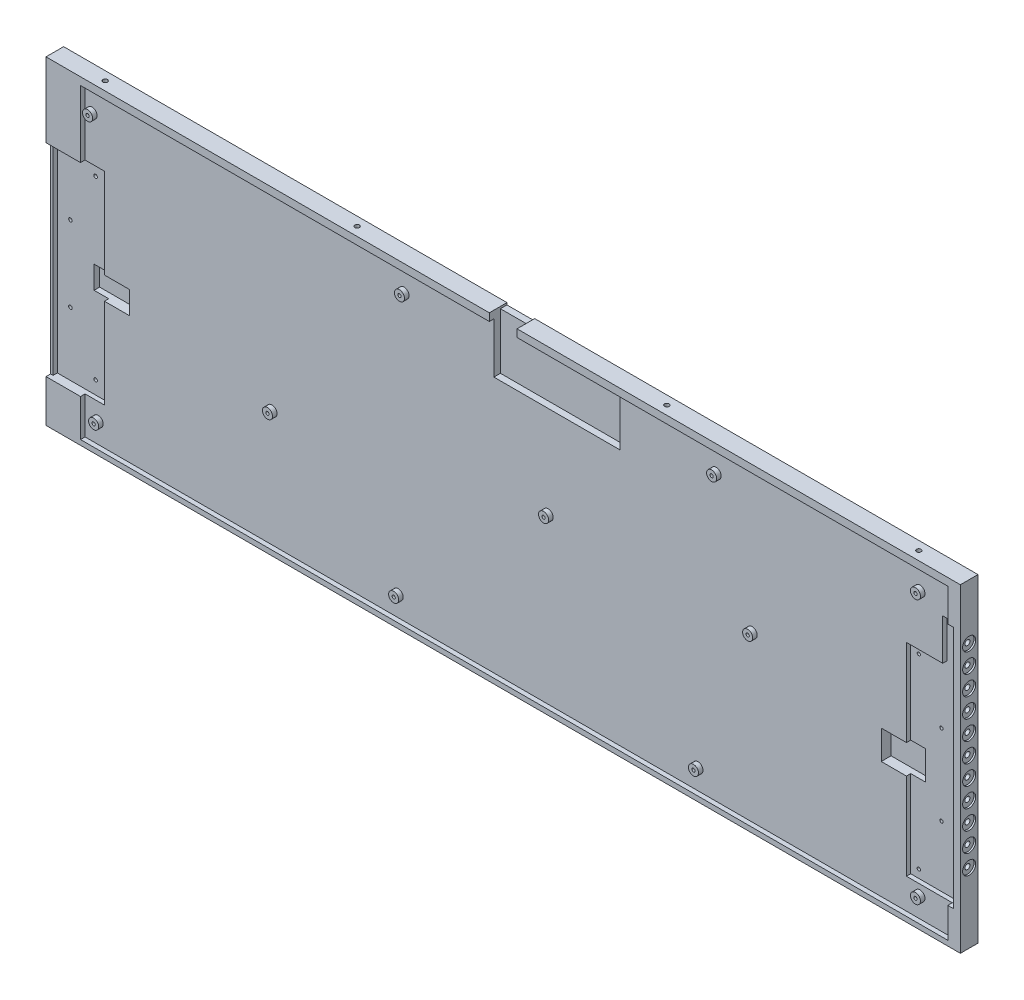
from build123d import *

# Parameters (mm, degrees)
SKETCH_1_W                      = 348.235
SKETCH_1_H                      = 124.71
EXTRUDE_1_DEPTH                 = 7
SKETCH_2_W                      = 344.235
SKETCH_2_H                      = 120.71
CUT_EXTRUDE_1_DEPTH             = 1.8
SKETCH_3_R                      = 2
SKETCH_3_R_2                    = 0.65
EXTRUDE_2_DEPTH                 = 1.8
CUT_EXTRUDE_2_DEPTH             = 370.92869492
CUT_EXTRUDE_2_DEPTH_BACK        = 1.7
SKETCH_4_W                      = 9.7
SKETCH_4_H                      = 80.4
SKETCH_6_W                      = 15.8
SKETCH_6_H                      = 9
CUT_EXTRUDE_3_DEPTH             = 3.9
SKETCH_7_W                      = 3.5
SKETCH_7_H                      = 80.4
EXTRUDE_3_DEPTH                 = 11.7
SKETCH_8_R                      = 0.7
CUT_EXTRUDE_4_DEPTH             = 3
SKETCH_9_W                      = 1
SKETCH_9_H                      = 80.4
EXTRUDE_4_DEPTH                 = 1.7
CUT_EXTRUDE_5_DEPTH             = 370.92869492
CUT_EXTRUDE_5_DEPTH_BACK        = 1.7
SKETCH_10_W                     = 20.2
SKETCH_10_H                     = 80.4
CUT_EXTRUDE_6_DEPTH             = 370.908704041
CUT_EXTRUDE_6_DEPTH_BACK        = 2.2
SKETCH_11_W                     = 15.8
SKETCH_11_H                     = 11.5
SKETCH_12_R                     = 0.65
CUT_EXTRUDE_7_DEPTH             = 3
SKETCH_13_W                     = 3
SKETCH_13_H                     = 124.71
EXTRUDE_5_DEPTH                 = 7
CUT_EXTRUDE_8_REACH             = 374.754
SKETCH_14_W                     = 6
SKETCH_14_H                     = 96.71
CUT_EXTRUDE_8_DIRECTION_2_DEPTH = 3
SKETCH_15_R                     = 2.6
CUT_EXTRUDE_9_DEPTH             = 0.7
SKETCH_15_3_R                   = 1
CUT_EXTRUDE_10_DEPTH            = 2.8
SKETCH_16_W                     = 362.935
SKETCH_16_H                     = 7
EXTRUDE_6_DEPTH                 = 0.2
SKETCH_17_W                     = 362.935
SKETCH_17_H                     = 7
EXTRUDE_7_DEPTH                 = 0.2
SKETCH_23_R                     = 5.6
SKETCH_23_R_2                   = 4.1
CUT_EXTRUDE_14_DEPTH            = 1
SKETCH_25_W                     = 362.935
SKETCH_25_H                     = 7
EXTRUDE_8_DEPTH                 = 1.8
SKETCH_26_W                     = 344.235
SKETCH_26_H                     = 1
CUT_EXTRUDE_15_DEPTH            = 1.8
SKETCH_27_W                     = 11
SKETCH_27_H                     = 7
CUT_EXTRUDE_16_DEPTH            = 0.8
CUT_EXTRUDE_17_DEPTH            = 373.821100965
CUT_EXTRUDE_17_DEPTH_BACK       = 2.6
SKETCH_28_W                     = 11
SKETCH_28_H                     = 2.2
SKETCH_29_W                     = 7
SKETCH_29_H                     = 0.2
CUT_EXTRUDE_18_DEPTH            = 384.892331683
CUT_EXTRUDE_START               = 1.8
SKETCH_24_R                     = 0.9
CUT_EXTRUDE_19_DEPTH            = 2
CUT_EXTRUDE_START_2             = -122.91
SKETCH_24_3_R                   = 0.9
CUT_EXTRUDE_20_DEPTH            = 2


with BuildPart() as part:
    # 草图1 → 凸台-拉伸1 (new body)
    with BuildSketch(Plane.XY):
        with Locations((174.1175, -62.355)):
            Rectangle(SKETCH_1_W, SKETCH_1_H)
    extrude(amount=EXTRUDE_1_DEPTH)

    # 草图2 → 切除-拉伸1 (cut)
    with BuildSketch(Plane.XY.offset(7)):
        with Locations((174.1175, -62.355)):
            Rectangle(SKETCH_2_W, SKETCH_2_H)
    extrude(amount=-CUT_EXTRUDE_1_DEPTH, mode=Mode.SUBTRACT)

    # 草图3 → 凸台-拉伸2 (add)
    # profile 1 of 11: a face of its own
    with BuildSketch(Plane.XY.offset(5.2)):
        with Locations((4.8, -9.9)):
            Circle(SKETCH_3_R)
        with Locations((4.8, -9.9)):
            Circle(SKETCH_3_R_2, mode=Mode.SUBTRACT)
    # profile 2 of 11: a face of its own
    with BuildSketch(Plane.XY.offset(5.2)):
        with Locations((7.2, -114.7)):
            Circle(SKETCH_3_R)
        with Locations((7.2, -114.7)):
            Circle(SKETCH_3_R_2, mode=Mode.SUBTRACT)
    # profile 3 of 11: a face of its own
    with BuildSketch(Plane.XY.offset(5.2)):
        with Locations((76.2, -76.6)):
            Circle(SKETCH_3_R)
        with Locations((76.2, -76.6)):
            Circle(SKETCH_3_R_2, mode=Mode.SUBTRACT)
    # profile 4 of 11: a face of its own
    with BuildSketch(Plane.XY.offset(5.2)):
        with Locations((128.6, -9.9)):
            Circle(SKETCH_3_R)
        with Locations((128.6, -9.9)):
            Circle(SKETCH_3_R_2, mode=Mode.SUBTRACT)
    # profile 5 of 11: a face of its own
    with BuildSketch(Plane.XY.offset(5.2)):
        with Locations((126.3, -114.7)):
            Circle(SKETCH_3_R)
        with Locations((126.3, -114.7)):
            Circle(SKETCH_3_R_2, mode=Mode.SUBTRACT)
    # profile 6 of 11: a face of its own
    with BuildSketch(Plane.XY.offset(5.2)):
        with Locations((185.8, -57.5)):
            Circle(SKETCH_3_R)
        with Locations((185.8, -57.5)):
            Circle(SKETCH_3_R_2, mode=Mode.SUBTRACT)
    # profile 7 of 11: a face of its own
    with BuildSketch(Plane.XY.offset(5.2)):
        with Locations((252.5, -9.9)):
            Circle(SKETCH_3_R)
        with Locations((252.5, -9.9)):
            Circle(SKETCH_3_R_2, mode=Mode.SUBTRACT)
    # profile 8 of 11: a face of its own
    with BuildSketch(Plane.XY.offset(5.2)):
        with Locations((245.3, -114.7)):
            Circle(SKETCH_3_R)
        with Locations((245.3, -114.7)):
            Circle(SKETCH_3_R_2, mode=Mode.SUBTRACT)
    # profile 9 of 11: a face of its own
    with BuildSketch(Plane.XY.offset(5.2)):
        with Locations((333.4, -9.9)):
            Circle(SKETCH_3_R)
        with Locations((333.4, -9.9)):
            Circle(SKETCH_3_R_2, mode=Mode.SUBTRACT)
    # profile 10 of 11: a face of its own
    with BuildSketch(Plane.XY.offset(5.2)):
        with Locations((333.4, -114.7)):
            Circle(SKETCH_3_R)
        with Locations((333.4, -114.7)):
            Circle(SKETCH_3_R_2, mode=Mode.SUBTRACT)
    # profile 11 of 11: a face of its own
    with BuildSketch(Plane.XY.offset(5.2)):
        with Locations((266.8, -57.5)):
            Circle(SKETCH_3_R)
        with Locations((266.8, -57.5)):
            Circle(SKETCH_3_R_2, mode=Mode.SUBTRACT)
    extrude(amount=EXTRUDE_2_DEPTH)

    # 草图4 → 切除-拉伸2 (cut, two sides: drawn at the far end of the back side and taken through both)
    with BuildSketch(Plane.XY.offset(5.2).offset(-CUT_EXTRUDE_2_DEPTH_BACK)):
        with Locations((4.85, -67.71)):
            Rectangle(SKETCH_4_W, SKETCH_4_H)
    extrude(amount=CUT_EXTRUDE_2_DEPTH + CUT_EXTRUDE_2_DEPTH_BACK, mode=Mode.SUBTRACT)

    # 草图6 → 切除-拉伸3 (cut)
    with BuildSketch(Plane.XY.offset(5.2)):
        with Locations((11.8, -67.71)):
            Rectangle(SKETCH_6_W, SKETCH_6_H)
    extrude(amount=-CUT_EXTRUDE_3_DEPTH, mode=Mode.SUBTRACT)

    # 草图7 → 凸台-拉伸3 (add)
    with BuildSketch(Plane.ZY):
        Polygon((7, 0), (0, 0), (0, -27.51), (3.5, -27.51), (7, -27.51), align=None)
        with Locations((1.75, -67.71)):
            Rectangle(SKETCH_7_W, SKETCH_7_H)
        Polygon((3.5, -107.91), (0, -107.91), (0, -124.71), (7, -124.71), (7, -107.91), align=None)
    extrude(amount=EXTRUDE_3_DEPTH)

    # 草图8 → 切除-拉伸4 (cut)
    with BuildSketch(Plane.XY.offset(3.5)):
        with Locations((-5.5, -82.714)):
            Circle(SKETCH_8_R)
        with Locations((4.5, -102.714)):
            Circle(SKETCH_8_R)
        with Locations((-5.5, -52.714)):
            Circle(SKETCH_8_R)
        with Locations((4.5, -32.714)):
            Circle(SKETCH_8_R)
    extrude(amount=-CUT_EXTRUDE_4_DEPTH, mode=Mode.SUBTRACT)

    # 草图9 → 凸台-拉伸4 (add)
    with BuildSketch(Plane.XY.offset(3.5)):
        with Locations((-11.2, -67.71)):
            Rectangle(SKETCH_9_W, SKETCH_9_H)
    extrude(amount=EXTRUDE_4_DEPTH)

    # 草图10 → 切除-拉伸5 (cut, two sides: drawn at the far end of the back side and taken through both)
    with BuildSketch(Plane.XY.offset(5.2).offset(-CUT_EXTRUDE_5_DEPTH_BACK)):
        with Locations((338.135, -70.51)):
            Rectangle(SKETCH_10_W, SKETCH_10_H)
    extrude(amount=CUT_EXTRUDE_5_DEPTH + CUT_EXTRUDE_5_DEPTH_BACK, mode=Mode.SUBTRACT)

    # 草图11 → 切除-拉伸6 (cut, two sides: drawn at the far end of the back side and taken through both)
    with BuildSketch(Plane.XY.offset(3.5).offset(-CUT_EXTRUDE_6_DEPTH_BACK)):
        with Locations((325.935, -70.51)):
            Rectangle(SKETCH_11_W, SKETCH_11_H)
    extrude(amount=CUT_EXTRUDE_6_DEPTH + CUT_EXTRUDE_6_DEPTH_BACK, mode=Mode.SUBTRACT)

    # 草图12 → 切除-拉伸7 (cut)
    with BuildSketch(Plane.XY.offset(3.5)):
        with Locations((331.235, -107.514)):
            Circle(SKETCH_12_R)
        with Locations((340.235, -86.514)):
            Circle(SKETCH_12_R)
        with Locations((340.235, -54.514)):
            Circle(SKETCH_12_R)
        with Locations((331.235, -33.514)):
            Circle(SKETCH_12_R)
    extrude(amount=-CUT_EXTRUDE_7_DEPTH, mode=Mode.SUBTRACT)

    # 草图13 → 凸台-拉伸5 (add)
    with BuildSketch(Plane(origin=(0, 0, 0), x_dir=(-1, 0, 0), z_dir=(0, 0, -1))):
        with Locations((-349.735, -62.355)):
            Rectangle(SKETCH_13_W, SKETCH_13_H)
    extrude(amount=-EXTRUDE_5_DEPTH)

    # 切除-拉伸8: up to this face of the body (flat: up to its plane)
    cut_extrude_8_end = Plane(part.part.faces().sort_by_distance((338.452628763, -70.509986317, 3.5))[0])
    # 草图14 → 切除-拉伸8 (cut, up to the picked face)
    with BuildSketch(Plane.XY.offset(5.2), mode=Mode.PRIVATE) as cut_extrude_8_sk1:
        with Locations((345.435, -62.355)):
            Rectangle(SKETCH_14_W, SKETCH_14_H)
    cut_extrude_8_tool1 = split(extrude(cut_extrude_8_sk1.sketch, amount=-CUT_EXTRUDE_8_REACH, mode=Mode.PRIVATE), bisect_by=cut_extrude_8_end, keep=Keep.BOTH, mode=Mode.PRIVATE)
    add(cut_extrude_8_tool1.solids().sort_by(Axis((345.435, -62.355, 5.2), (0, 0, -1)))[0], mode=Mode.SUBTRACT)

    # 草图14 → 切除-拉伸8 direction 2 (cut)
    with BuildSketch(Plane.XY.offset(5.2)):
        with Locations((345.435, -62.355)):
            Rectangle(SKETCH_14_W, SKETCH_14_H)
    extrude(amount=CUT_EXTRUDE_8_DIRECTION_2_DEPTH, mode=Mode.SUBTRACT)

    # 草图15 → 切除-拉伸9 (cut)
    with BuildSketch(Plane(origin=(351.235, 0, 0), x_dir=(0, 0, -1), z_dir=(1, 0, 0))):
        with Locations((-3.5, -20)):
            Circle(SKETCH_15_R)
        with Locations((-3.5, -27.700909091)):
            Circle(SKETCH_15_R)
        with Locations((-3.5, -35.401818182)):
            Circle(SKETCH_15_R)
        with Locations((-3.5, -43.102727273)):
            Circle(SKETCH_15_R)
        with Locations((-3.5, -50.803636364)):
            Circle(SKETCH_15_R)
        with Locations((-3.5, -58.504545455)):
            Circle(SKETCH_15_R)
        with Locations((-3.5, -66.205454545)):
            Circle(SKETCH_15_R)
        with Locations((-3.5, -73.906363636)):
            Circle(SKETCH_15_R)
        with Locations((-3.5, -81.607272727)):
            Circle(SKETCH_15_R)
        with Locations((-3.5, -89.308181818)):
            Circle(SKETCH_15_R)
        with Locations((-3.5, -97.009090909)):
            Circle(SKETCH_15_R)
    extrude(amount=-CUT_EXTRUDE_9_DEPTH, mode=Mode.SUBTRACT)

    # 草图15<3> → 切除-拉伸10 (cut)
    with BuildSketch(Plane(origin=(351.235, 0, 0), x_dir=(0, 0, -1), z_dir=(1, 0, 0))):
        with Locations((-3.5, -20)):
            Circle(SKETCH_15_3_R)
        with Locations((-3.5, -27.700909091)):
            Circle(SKETCH_15_3_R)
        with Locations((-3.5, -35.401818182)):
            Circle(SKETCH_15_3_R)
        with Locations((-3.5, -43.102727273)):
            Circle(SKETCH_15_3_R)
        with Locations((-3.5, -50.803636364)):
            Circle(SKETCH_15_3_R)
        with Locations((-3.5, -58.504545455)):
            Circle(SKETCH_15_3_R)
        with Locations((-3.5, -66.205454545)):
            Circle(SKETCH_15_3_R)
        with Locations((-3.5, -73.906363636)):
            Circle(SKETCH_15_3_R)
        with Locations((-3.5, -81.607272727)):
            Circle(SKETCH_15_3_R)
        with Locations((-3.5, -89.308181818)):
            Circle(SKETCH_15_3_R)
        with Locations((-3.5, -97.009090909)):
            Circle(SKETCH_15_3_R)
    extrude(amount=-CUT_EXTRUDE_10_DEPTH, mode=Mode.SUBTRACT)

    # 草图16 → 凸台-拉伸6 (add)
    with BuildSketch(Plane(origin=(0, 0, 0), x_dir=(1, 0, 0), z_dir=(0, 1, 0))):
        with Locations((169.7675, -3.5)):
            Rectangle(SKETCH_16_W, SKETCH_16_H)
    extrude(amount=EXTRUDE_6_DEPTH)

    # 草图17 → 凸台-拉伸7 (add)
    with BuildSketch(Plane.XZ.offset(124.71)):
        with Locations((169.7675, 3.5)):
            Rectangle(SKETCH_17_W, SKETCH_17_H)
    extrude(amount=EXTRUDE_7_DEPTH)

    # 草图23 → 切除-拉伸14 (cut)
    with BuildSketch(Plane(origin=(0, 0, 0), x_dir=(-1, 0, 0), z_dir=(0, 0, -1))):
        with Locations((-331.235, -19.8)):
            Circle(SKETCH_23_R)
        with Locations((-231.235, -19.8)):
            Circle(SKETCH_23_R)
        with Locations((-108.3, -19.8)):
            Circle(SKETCH_23_R)
        with Locations((-8.3, -19.8)):
            Circle(SKETCH_23_R)
        with Locations((-331.235, -104.91)):
            Circle(SKETCH_23_R_2)
        with Locations((-231.235, -104.91)):
            Circle(SKETCH_23_R_2)
        with Locations((-108.3, -104.91)):
            Circle(SKETCH_23_R_2)
        with Locations((-8.3, -104.91)):
            Circle(SKETCH_23_R_2)
    extrude(amount=-CUT_EXTRUDE_14_DEPTH, mode=Mode.SUBTRACT)

    # 草图25 → 凸台-拉伸8 (add)
    with BuildSketch(Plane(origin=(0, 0.2, 0), x_dir=(1, 0, 0), z_dir=(0, 1, 0))):
        with Locations((169.7675, -3.5)):
            Rectangle(SKETCH_25_W, SKETCH_25_H)
    extrude(amount=EXTRUDE_8_DEPTH)

    # 草图26 → 切除-拉伸15 (cut)
    with BuildSketch(Plane.XY.offset(7)):
        with Locations((174.1175, -1.5)):
            Rectangle(SKETCH_26_W, SKETCH_26_H)
    extrude(amount=-CUT_EXTRUDE_15_DEPTH, mode=Mode.SUBTRACT)

    # 草图27 → 切除-拉伸16 (cut)
    with BuildSketch(Plane(origin=(0, 2, 0), x_dir=(1, 0, 0), z_dir=(0, 1, 0))):
        with Locations((169.7675, -3.5)):
            Rectangle(SKETCH_27_W, SKETCH_27_H)
    extrude(amount=-CUT_EXTRUDE_16_DEPTH, mode=Mode.SUBTRACT)

    # 草图28 → 切除-拉伸17 (cut, two sides: drawn at the far end of the back side and taken through both)
    with BuildSketch(Plane.XY.offset(5.2).offset(-CUT_EXTRUDE_17_DEPTH_BACK)):
        Polygon((175.2675, -1), (164.2675, -1), (164.2675, -21), (214.2675, -21), (214.2675, -1), align=None)
        with Locations((169.7675, 0.1)):
            Rectangle(SKETCH_28_W, SKETCH_28_H)
    extrude(amount=CUT_EXTRUDE_17_DEPTH + CUT_EXTRUDE_17_DEPTH_BACK, mode=Mode.SUBTRACT)

    # 草图29 → 切除-拉伸18 (cut, through all)
    with BuildSketch(Plane.ZY.offset(11.7)):
        with Locations((3.5, -124.81)):
            Rectangle(SKETCH_29_W, SKETCH_29_H)
    extrude(amount=-CUT_EXTRUDE_18_DEPTH, mode=Mode.SUBTRACT)

    # 草图24 → 切除-拉伸19 (cut)
    with BuildSketch(Plane(origin=(0, 0.2, 0), x_dir=(1, 0, 0), z_dir=(0, 1, 0)).offset(CUT_EXTRUDE_START)):
        with Locations(Location((8.3, -3.5, 0), (0, 0, 270))):
            Circle(SKETCH_24_R)
        with Locations(Location((108.3, -3.5, 0), (0, 0, 270))):
            Circle(SKETCH_24_R)
        with Locations(Location((231.235, -3.5, 0), (0, 0, 270))):
            Circle(SKETCH_24_R)
        with Locations(Location((331.235, -3.5, 0), (0, 0, 270))):
            Circle(SKETCH_24_R)
    extrude(amount=-CUT_EXTRUDE_19_DEPTH, mode=Mode.SUBTRACT)

    # 草图24<3> → 切除-拉伸20 (cut)
    with BuildSketch(Plane(origin=(0, 0.2, 0), x_dir=(1, 0, 0), z_dir=(0, 1, 0)).offset(CUT_EXTRUDE_START_2)):
        with Locations(Location((8.3, -3.5, 0), (0, 0, 270))):
            Circle(SKETCH_24_3_R)
        with Locations(Location((108.3, -3.5, 0), (0, 0, 270))):
            Circle(SKETCH_24_3_R)
        with Locations(Location((231.235, -3.5, 0), (0, 0, 270))):
            Circle(SKETCH_24_3_R)
        with Locations(Location((331.235, -3.5, 0), (0, 0, 270))):
            Circle(SKETCH_24_3_R)
    extrude(amount=-CUT_EXTRUDE_20_DEPTH, mode=Mode.SUBTRACT)


solid = part.part
